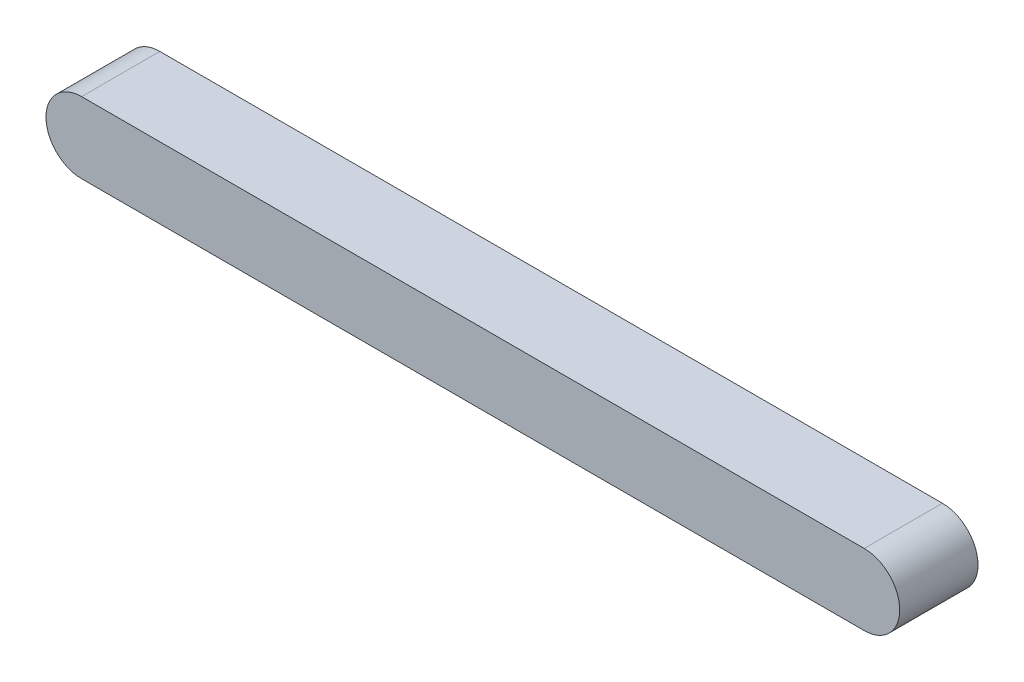
from build123d import *

# Parameters (mm, degrees)
BOSS_EXTRUDE1_DEPTH = 2.2


with BuildPart() as part:
    # Sketch1 → Boss-Extrude1 (new body)
    with BuildSketch(Plane.XY):
        with BuildLine():
            Line((-11, 1), (11, 1))
            ThreePointArc((11, 1), (12, 0), (11, -1))
            Line((11, -1), (-11, -1))
            ThreePointArc((-11, -1), (-12, 0), (-11, 1))
        make_face()
    extrude(amount=BOSS_EXTRUDE1_DEPTH)


solid = part.part
